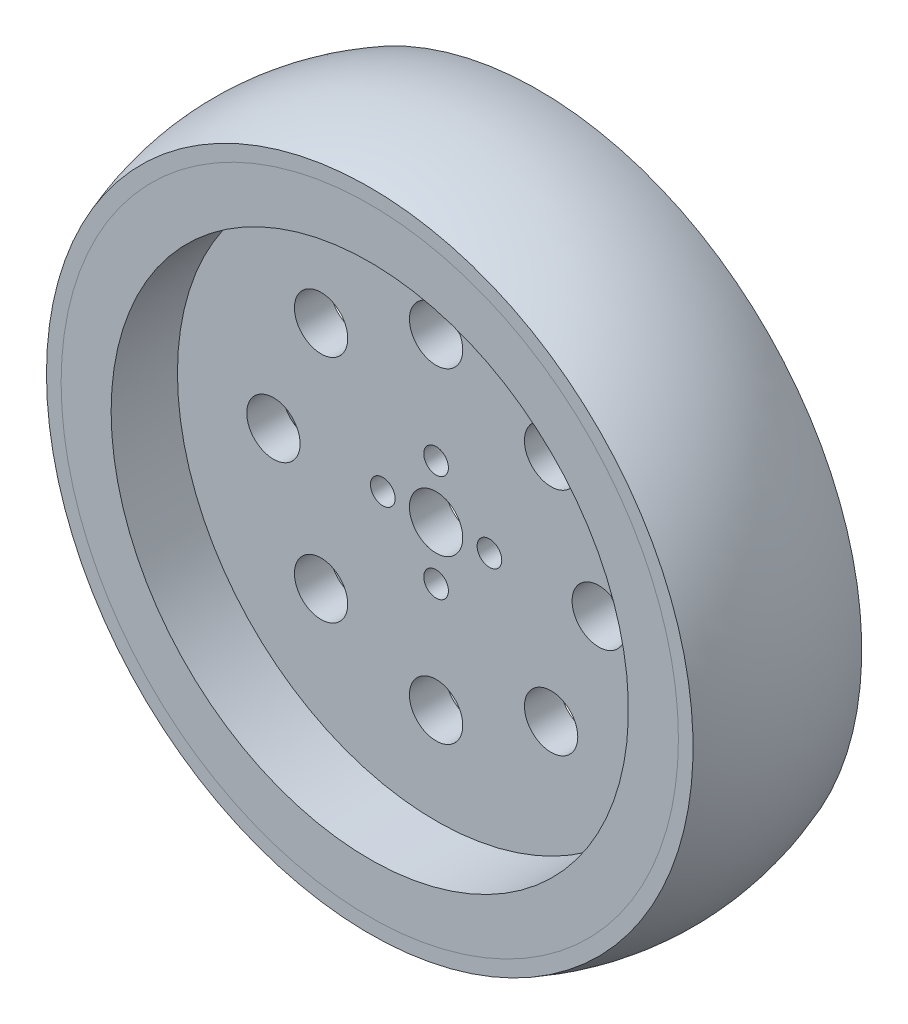
from build123d import *

# Parameters (mm, degrees)
CUT_EXTRUDE1_DEPTH      = 73.947258501
CUT_EXTRUDE1_DEPTH_BACK = 73.947258501
SKETCH3_R               = 1.85
SKETCH3_R_2             = 4


with BuildPart() as part:
    # Sketch1 → Revolve1 (revolve)
    with BuildSketch(Plane(origin=(0, 0, 0), x_dir=(1, 0, 0), z_dir=(0, 1, 0)), mode=Mode.PRIVATE) as revolve1_sk:
        Polygon((4, -2.7), (38.8, -2.7), (38.8, -12.65), (46.3, -12.65), (46.3, -10.65), (44, -10.65), (44, 10.65), (46.3, 10.65), (46.3, 12.65), (38.8, 12.65), (38.8, 2.7), (4, 2.7), align=None)
    revolve(revolve1_sk.sketch.rotate(Axis((0, 0, -12.65), (0, 0, 1)), 180), axis=Axis((0, 0, -12.65), (0, 0, 1)))

    # Sketch3 → Cut-Extrude1 (cut, two sides: drawn at the far end of the back side and taken through both)
    with BuildSketch(Plane.XY.offset(-CUT_EXTRUDE1_DEPTH_BACK)):
        with Locations((0, 8)):
            Circle(SKETCH3_R)
        with Locations((8, 0)):
            Circle(SKETCH3_R)
        with Locations((0, -8)):
            Circle(SKETCH3_R)
        with Locations((-8, 0)):
            Circle(SKETCH3_R)
        with Locations((0, 24.4)):
            Circle(SKETCH3_R_2)
        with Locations((17.253405461, 17.253405461)):
            Circle(SKETCH3_R_2)
        with Locations((24.4, 0)):
            Circle(SKETCH3_R_2)
        with Locations((17.253405461, -17.253405461)):
            Circle(SKETCH3_R_2)
        with Locations((0, -24.4)):
            Circle(SKETCH3_R_2)
        with Locations((-17.253405461, -17.253405461)):
            Circle(SKETCH3_R_2)
        with Locations((-24.4, 0)):
            Circle(SKETCH3_R_2)
        with Locations((-17.253405461, 17.253405461)):
            Circle(SKETCH3_R_2)
    extrude(amount=CUT_EXTRUDE1_DEPTH + CUT_EXTRUDE1_DEPTH_BACK, mode=Mode.SUBTRACT)


with BuildPart() as body_2:
    # Sketch2 → Revolve2 (revolve)
    with BuildSketch(Plane(origin=(0, 0, 0), x_dir=(1, 0, 0), z_dir=(0, 1, 0)), mode=Mode.PRIVATE) as revolve2_sk:
        with BuildLine():
            Line((44, -10.65), (44, 10.65))
            Line((44, 10.65), (46.3, 10.65))
            Line((46.3, 10.65), (46.3, 12.65))
            Line((46.3, 12.65), (48.5, 12.65))
            ThreePointArc((48.5, 12.65), (50.8, 0), (48.5, -12.65))
            Line((48.5, -12.65), (46.3, -12.65))
            Line((46.3, -12.65), (46.3, -10.65))
            Line((46.3, -10.65), (44, -10.65))
        make_face()
    revolve(revolve2_sk.sketch.rotate(Axis((0, 0, -12.65), (0, 0, 1)), 180), axis=Axis((0, 0, -12.65), (0, 0, 1)))


solid = Compound([part.part, body_2.part])
